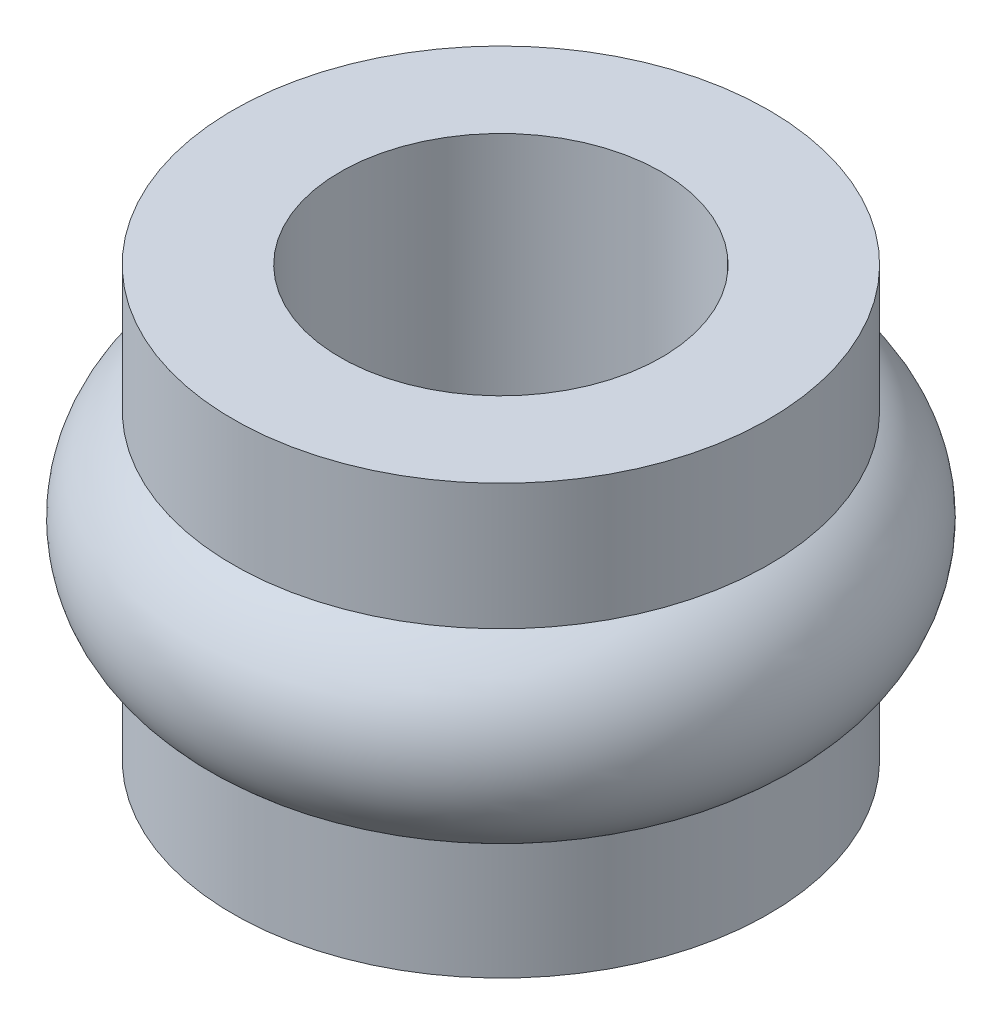
from build123d import *


with BuildPart() as part:
    # Sketch1 → Revolve1 (revolve)
    with BuildSketch(Plane.XY, mode=Mode.PRIVATE) as revolve1_sk:
        with BuildLine():
            Line((1.5, 0), (1.5, 4))
            Line((1.5, 4), (2.5, 4))
            Line((2.5, 4), (2.5, 2.823694221))
            ThreePointArc((2.5, 2.823694221), (3, 1.957668817), (2.5, 1.091643413))
            Line((2.5, 1.091643413), (2.5, 0))
            Line((2.5, 0), (1.5, 0))
        make_face()
    revolve(revolve1_sk.sketch.rotate(Axis((0, 0, 0), (0, 1, 0)), 90), axis=Axis((0, 0, 0), (0, 1, 0)))


solid = part.part
